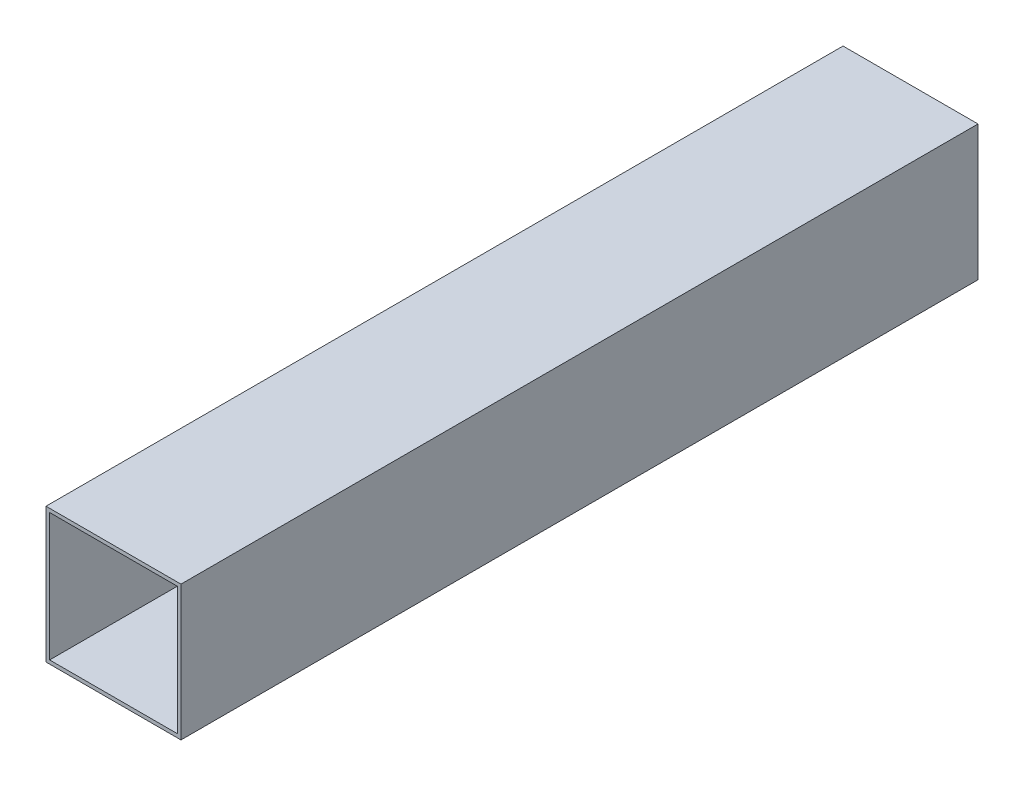
from build123d import *

# Parameters (mm, degrees)
CROQUIS1_W              = 50.8
CROQUIS1_H              = 50.8
CROQUIS1_W_2            = 48.0568
CROQUIS1_H_2            = 48.0568
SALIENTE_EXTRUIR1_DEPTH = 300


with BuildPart() as part:
    # Croquis1 → Saliente-Extruir1 (new body)
    with BuildSketch(Plane.XY):
        with Locations((0, -80)):
            Rectangle(CROQUIS1_W, CROQUIS1_H)
        with Locations((0, -80)):
            Rectangle(CROQUIS1_W_2, CROQUIS1_H_2, mode=Mode.SUBTRACT)
    extrude(amount=SALIENTE_EXTRUIR1_DEPTH)


solid = part.part
